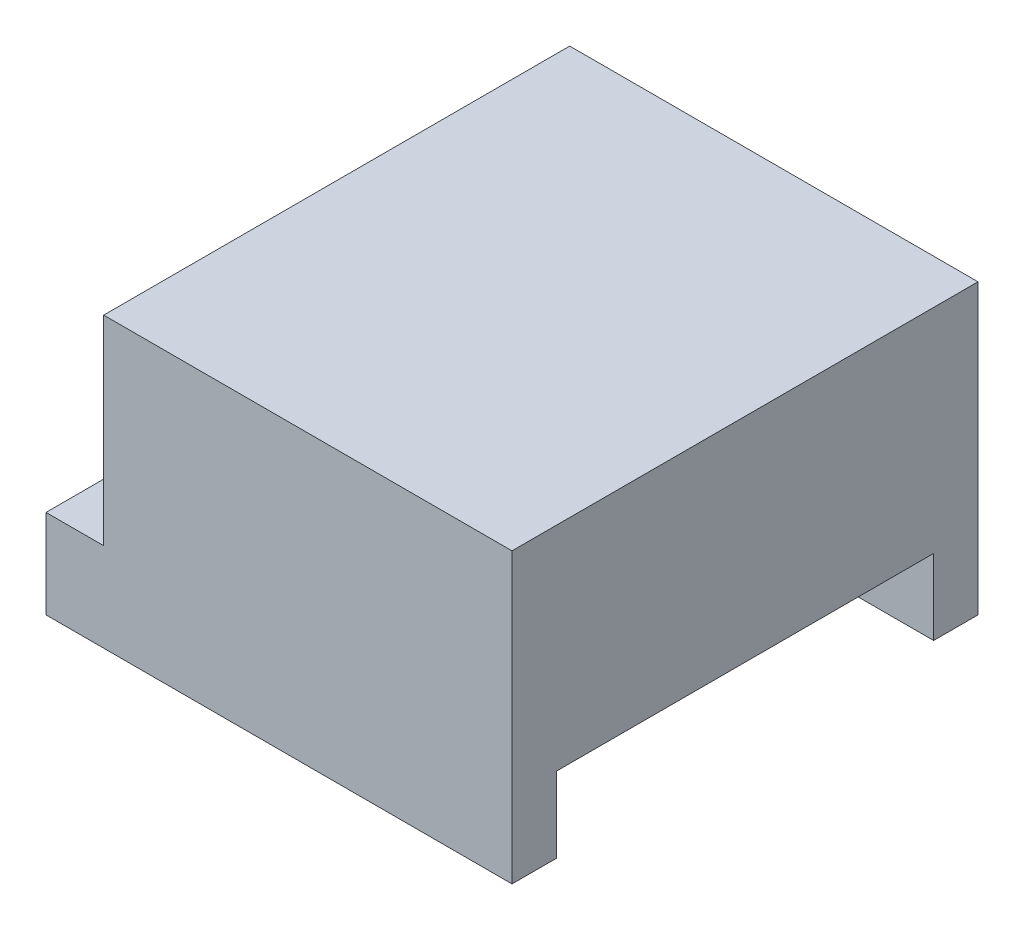
from build123d import *

# Parameters (mm, degrees)
SKETCH1_W           = 92
SKETCH1_H           = 105
BOSS_EXTRUDE1_DEPTH = 45
SKETCH2_W           = 105
SKETCH2_H           = 105
BOSS_EXTRUDE2_DEPTH = 3
SKETCH3_W           = 105
SKETCH3_H           = 10
BOSS_EXTRUDE3_DEPTH = 17
SKETCH4_R           = 1.5
CUT_EXTRUDE1_DEPTH  = 35


with BuildPart() as part:
    # Sketch1 → Boss-Extrude1 (new body)
    with BuildSketch(Plane(origin=(0, 0, 0), x_dir=(1, 0, 0), z_dir=(0, 1, 0))):
        Rectangle(SKETCH1_W, SKETCH1_H)
    extrude(amount=BOSS_EXTRUDE1_DEPTH)

    # Sketch2 → Boss-Extrude2 (add)
    with BuildSketch(Plane.XZ):
        with Locations((-6.5, 0)):
            Rectangle(SKETCH2_W, SKETCH2_H)
    extrude(amount=BOSS_EXTRUDE2_DEPTH)

    # Sketch3 → Boss-Extrude3 (add)
    with BuildSketch(Plane.XZ.offset(3)):
        with Locations((-6.5, 47.5)):
            Rectangle(SKETCH3_W, SKETCH3_H)
    boss_extrude3 = extrude(amount=BOSS_EXTRUDE3_DEPTH)

    # Sketch4 → Cut-Extrude1 (cut)
    with BuildSketch(Plane(origin=(0, -20, 0), x_dir=(-1, 0, 0), z_dir=(0, -1, 0))):
        with Locations(Location((-41.5, -47.5, 0), (0, 0, 90))):
            Circle(SKETCH4_R)
        with Locations(Location((38, -47.5, 0), (0, 0, 90))):
            Circle(SKETCH4_R)
    cut_extrude1 = extrude(amount=-CUT_EXTRUDE1_DEPTH, mode=Mode.SUBTRACT)

    # Mirror1: Boss-Extrude3, Cut-Extrude1 across plane
    add(boss_extrude3.mirror(Plane.XY))
    add(cut_extrude1.mirror(Plane.XY), mode=Mode.SUBTRACT)


solid = part.part
